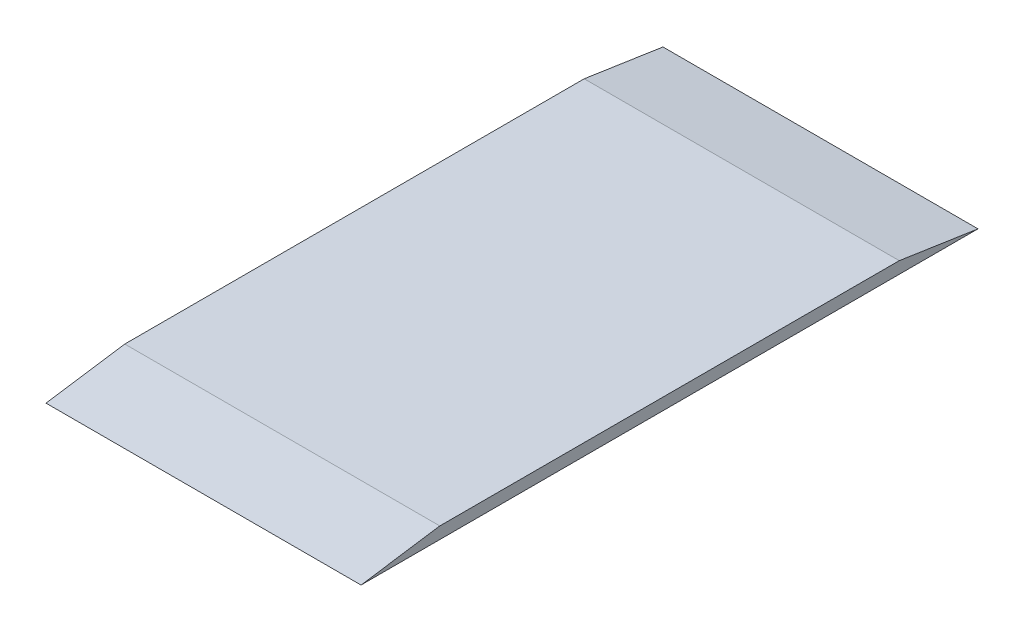
from build123d import *

# Parameters (mm, degrees)
BOSS_EXTRUDE1_DEPTH = 12


with BuildPart() as part:
    # Sketch1 → Boss-Extrude1 (new, symmetric)
    with BuildSketch(Plane(origin=(0, 0, 0), x_dir=(0, 0, -1), z_dir=(1, 0, 0))):
        Polygon((23.5, 0), (-23.5, 0), (-17.5, 0.9), (17.5, 0.9), align=None)
    extrude(amount=BOSS_EXTRUDE1_DEPTH, both=True)


solid = part.part
